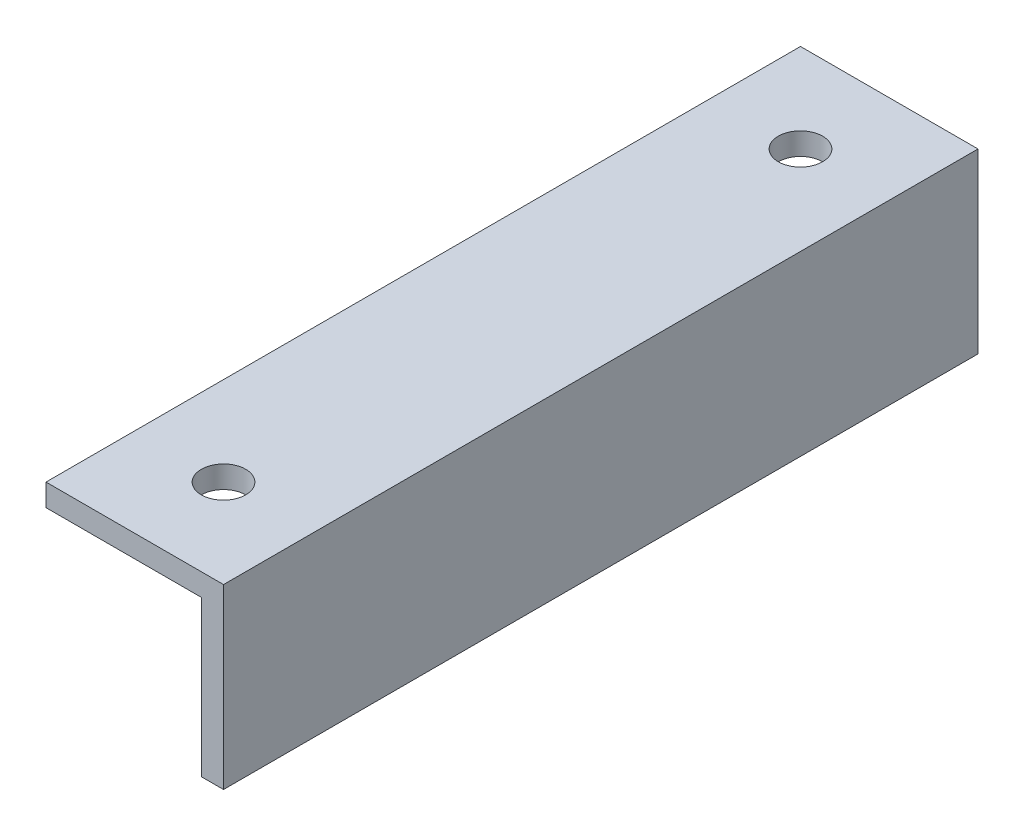
from build123d import *

# Parameters (mm, degrees)
BOSS_EXTRUDE1_DEPTH = 107.95
CUT_EXTRUDE1_REACH  = 115.103
SKETCH2_R           = 3.175


with BuildPart() as part:
    # Sketch1 → Boss-Extrude1 (new body)
    with BuildSketch(Plane.XY):
        Polygon((0, 0), (25.4, 0), (25.4, -25.4), (22.225, -25.4), (22.225, -3.175), (0, -3.175), align=None)
    extrude(amount=BOSS_EXTRUDE1_DEPTH)

    # Sketch2 → Cut-Extrude1 (cut, up to next)
    with BuildSketch(Plane.XZ.offset(3.175), mode=Mode.PRIVATE) as cut_extrude1_sk1:
        with Locations(Location((12.7, 12.7, 0), (0, 0, 270))):
            Circle(SKETCH2_R)
    cut_extrude1_tool1 = extrude(cut_extrude1_sk1.sketch, amount=-CUT_EXTRUDE1_REACH, mode=Mode.PRIVATE) & part.part
    # Sketch2 → Cut-Extrude1 (cut, up to next)
    with BuildSketch(Plane.XZ.offset(3.175), mode=Mode.PRIVATE) as cut_extrude1_sk2:
        with Locations(Location((12.7, 95.25, 0), (0, 0, 270))):
            Circle(SKETCH2_R)
    cut_extrude1_tool2 = extrude(cut_extrude1_sk2.sketch, amount=-CUT_EXTRUDE1_REACH, mode=Mode.PRIVATE) & part.part
    add(cut_extrude1_tool1.solids().sort_by_distance((12.7, -3.175, 12.7))[0], mode=Mode.SUBTRACT)
    add(cut_extrude1_tool2.solids().sort_by_distance((12.7, -3.175, 95.25))[0], mode=Mode.SUBTRACT)


solid = part.part
